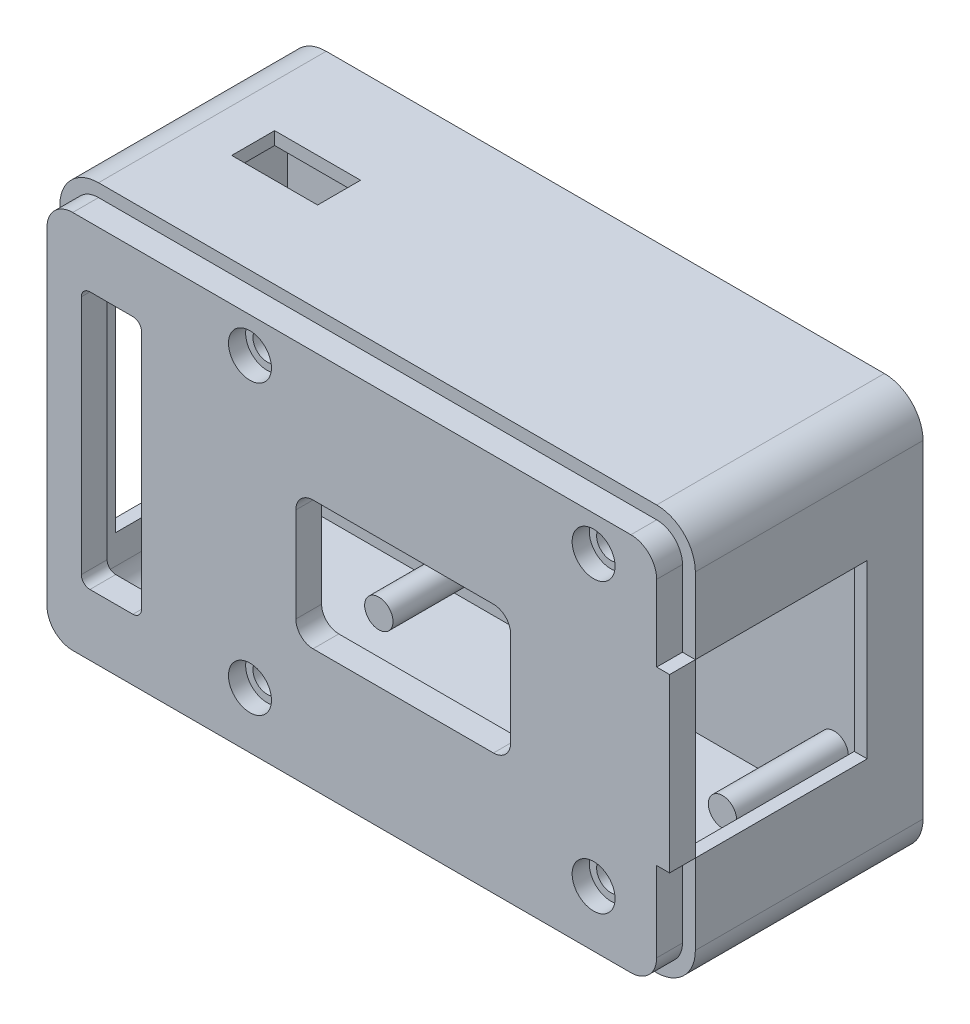
from build123d import *

# Parameters (mm, degrees)
EXTRUDE_3_DEPTH     = 25
EXTRUDE_4_DEPTH     = 1.5
SKETCH_3_R          = 1.65
EXTRUDE_6_DEPTH     = 13
CUT_EXTRUDE_1_REACH = 91.083
SKETCH_4_W          = 10
SKETCH_4_H          = 30
CUT_EXTRUDE_2_REACH = 91.083
SKETCH_5_W          = 20
SKETCH_5_H          = 20
CUT_EXTRUDE_3_REACH = 89.377
SKETCH_6_W          = 10
SKETCH_6_H          = 5
EXTRUDE_7_DEPTH     = 3
CUT_EXTRUDE_START   = -3
SKETCH_8_R          = 1.65
CUT_EXTRUDE_5_DEPTH = 3
CUT_EXTRUDE_6_DEPTH = 3
CUT_EXTRUDE_7_DEPTH = 3
SKETCH_11_R         = 2.5
CUT_EXTRUDE_8_DEPTH = 2


with BuildPart() as part:
    # 草图1 → 凸台-拉伸3 (new body)
    with BuildSketch(Plane.XY):
        with BuildLine():
            Line((-64.123292314, 2.629066518), (0.8422956, 2.629066518))
            ThreePointArc((0.8422956, 2.629066518), (4.024276115, 1.311047034), (5.3422956, -1.870933482))
            Line((5.3422956, -1.870933482), (5.3422956, -40.023345988))
            ThreePointArc((5.3422956, -40.023345988), (4.024276115, -43.205326503), (0.8422956, -44.523345988))
            Line((0.8422956, -44.523345988), (-64.123292314, -44.523345988))
            ThreePointArc((-64.123292314, -44.523345988), (-67.30527283, -43.205326503), (-68.623292314, -40.023345988))
            Line((-68.623292314, -40.023345988), (-68.623292314, -1.870933482))
            ThreePointArc((-68.623292314, -1.870933482), (-67.30527283, 1.311047034), (-64.123292314, 2.629066518))
        make_face()
        with BuildLine():
            Line((-64.123292314, 1.129066518), (0.8422956, 1.129066518))
            ThreePointArc((0.8422956, 1.129066518), (2.963615943, 0.250386862), (3.8422956, -1.870933482))
            Line((3.8422956, -1.870933482), (3.8422956, -40.023345988))
            ThreePointArc((3.8422956, -40.023345988), (2.963615943, -42.144666332), (0.8422956, -43.023345988))
            Line((0.8422956, -43.023345988), (-64.123292314, -43.023345988))
            ThreePointArc((-64.123292314, -43.023345988), (-66.244612658, -42.144666332), (-67.123292314, -40.023345988))
            Line((-67.123292314, -40.023345988), (-67.123292314, -1.870933482))
            ThreePointArc((-67.123292314, -1.870933482), (-66.244612658, 0.250386862), (-64.123292314, 1.129066518))
        make_face(mode=Mode.SUBTRACT)
    extrude(amount=-EXTRUDE_3_DEPTH)

    # 草图2 → 凸台-拉伸4 (add)
    with BuildSketch(Plane(origin=(0, 0, -25), x_dir=(-1, 0, 0), z_dir=(0, 0, -1))):
        with BuildLine():
            Line((64.123292314, 2.629066518), (-0.8422956, 2.629066518))
            ThreePointArc((-0.8422956, 2.629066518), (-4.024276115, 1.311047034), (-5.3422956, -1.870933482))
            Line((-5.3422956, -1.870933482), (-5.3422956, -40.023345988))
            ThreePointArc((-5.3422956, -40.023345988), (-4.024276115, -43.205326503), (-0.8422956, -44.523345988))
            Line((-0.8422956, -44.523345988), (64.123292314, -44.523345988))
            ThreePointArc((64.123292314, -44.523345988), (67.30527283, -43.205326503), (68.623292314, -40.023345988))
            Line((68.623292314, -40.023345988), (68.623292314, -1.870933482))
            ThreePointArc((68.623292314, -1.870933482), (67.30527283, 1.311047034), (64.123292314, 2.629066518))
        make_face()
    extrude(amount=EXTRUDE_4_DEPTH)

    # 草图3 → 凸台-拉伸6 (add)
    with BuildSketch(Plane.XY.offset(-25)):
        with Locations(Location((-43.499244891, -2.975515145, 0), (0, 0, 180))):
            Circle(SKETCH_3_R)
        with Locations(Location((-3.499244891, -2.975515145, 0), (0, 0, 180))):
            Circle(SKETCH_3_R)
        with Locations(Location((-3.499244891, -36.475515145, 0), (0, 0, 180))):
            Circle(SKETCH_3_R)
        with Locations(Location((-43.499244891, -36.475515145, 0), (0, 0, 180))):
            Circle(SKETCH_3_R)
    extrude(amount=EXTRUDE_6_DEPTH)

    # 草图4 → 切除-拉伸1 (cut, up to next)
    with BuildSketch(Plane(origin=(-67.123292314, 0, 0), x_dir=(0, 0, -1), z_dir=(1, 0, 0)), mode=Mode.PRIVATE) as cut_extrude_1_sk1:
        with Locations((10, -21.6396923)):
            Rectangle(SKETCH_4_W, SKETCH_4_H)
    cut_extrude_1_tool1 = extrude(cut_extrude_1_sk1.sketch, amount=-CUT_EXTRUDE_1_REACH, mode=Mode.PRIVATE) & part.part
    add(cut_extrude_1_tool1.solids().sort_by_distance((-67.123292, -21.639692, -10))[0], mode=Mode.SUBTRACT)

    # 草图5 → 切除-拉伸2 (cut, up to next)
    with BuildSketch(Plane.ZY.offset(-3.8422956), mode=Mode.PRIVATE) as cut_extrude_2_sk1:
        with Locations((-10, -20.713886057)):
            Rectangle(SKETCH_5_W, SKETCH_5_H)
    cut_extrude_2_tool1 = extrude(cut_extrude_2_sk1.sketch, amount=-CUT_EXTRUDE_2_REACH, mode=Mode.PRIVATE) & part.part
    add(cut_extrude_2_tool1.solids().sort_by_distance((3.842296, -20.713886, -10))[0], mode=Mode.SUBTRACT)

    # 草图6 → 切除-拉伸3 (cut, up to next)
    with BuildSketch(Plane(origin=(0, 2.629066518, 0), x_dir=(1, 0, 0), z_dir=(0, 1, 0)), mode=Mode.PRIVATE) as cut_extrude_3_sk1:
        with Locations((-54.123292314, 13)):
            Rectangle(SKETCH_6_W, SKETCH_6_H)
    cut_extrude_3_tool1 = extrude(cut_extrude_3_sk1.sketch, amount=-CUT_EXTRUDE_3_REACH, mode=Mode.PRIVATE) & part.part
    add(cut_extrude_3_tool1.solids().sort_by_distance((-54.123292, 2.629067, -13))[0], mode=Mode.SUBTRACT)


with BuildPart() as body_2:
    # 草图7 → 凸台-拉伸7 (new body)
    with BuildSketch(Plane.XY):
        with BuildLine():
            Line((5.3422956, -10.713886057), (5.3422956, -30.713886057))
            Line((5.3422956, -30.713886057), (3.8422956, -30.713886057))
            Line((3.8422956, -30.713886057), (3.8422956, -40.023345988))
            ThreePointArc((3.8422956, -40.023345988), (2.963615943, -42.144666332), (0.8422956, -43.023345988))
            Line((0.8422956, -43.023345988), (-64.123292314, -43.023345988))
            ThreePointArc((-64.123292314, -43.023345988), (-66.244612658, -42.144666332), (-67.123292314, -40.023345988))
            Line((-67.123292314, -40.023345988), (-67.123292314, -1.870933482))
            ThreePointArc((-67.123292314, -1.870933482), (-66.244612658, 0.250386862), (-64.123292314, 1.129066518))
            Line((-64.123292314, 1.129066518), (0.8422956, 1.129066518))
            ThreePointArc((0.8422956, 1.129066518), (2.963615943, 0.250386862), (3.8422956, -1.870933482))
            Line((3.8422956, -1.870933482), (3.8422956, -10.713886057))
            Line((3.8422956, -10.713886057), (5.3422956, -10.713886057))
        make_face()
    extrude(amount=EXTRUDE_7_DEPTH)

    # 草图8 → 切除-拉伸5 (cut)
    with BuildSketch(Plane.XY.offset(3).offset(CUT_EXTRUDE_START)):
        with Locations((-43.499244891, -2.975515145)):
            Circle(SKETCH_8_R)
        with Locations((-43.499244891, -36.475515145)):
            Circle(SKETCH_8_R)
        with Locations((-3.499244891, -2.975515145)):
            Circle(SKETCH_8_R)
        with Locations((-3.499244891, -36.475515145)):
            Circle(SKETCH_8_R)
    extrude(amount=CUT_EXTRUDE_5_DEPTH, mode=Mode.SUBTRACT)

    # 草图9 → 切除-拉伸6 (cut)
    with BuildSketch(Plane.XY.offset(3)):
        with BuildLine():
            Line((-62.123292314, -5.870933482), (-57.123292314, -5.870933482))
            ThreePointArc((-57.123292314, -5.870933482), (-56.416185533, -6.1638267), (-56.123292314, -6.870933482))
            Line((-56.123292314, -6.870933482), (-56.123292314, -34.870933482))
            ThreePointArc((-56.123292314, -34.870933482), (-56.416185533, -35.578040263), (-57.123292314, -35.870933482))
            Line((-57.123292314, -35.870933482), (-62.123292314, -35.870933482))
            ThreePointArc((-62.123292314, -35.870933482), (-62.830399096, -35.578040263), (-63.123292314, -34.870933482))
            Line((-63.123292314, -34.870933482), (-63.123292314, -6.870933482))
            ThreePointArc((-63.123292314, -6.870933482), (-62.830399096, -6.1638267), (-62.123292314, -5.870933482))
        make_face()
    extrude(amount=-CUT_EXTRUDE_6_DEPTH, mode=Mode.SUBTRACT)

    # 草图10 → 切除-拉伸7 (cut)
    with BuildSketch(Plane.XY.offset(3)):
        with BuildLine():
            Line((-36.1577044, -13.870933482), (-15.1577044, -13.870933482))
            ThreePointArc((-15.1577044, -13.870933482), (-13.743490838, -14.456719919), (-13.1577044, -15.870933482))
            Line((-13.1577044, -15.870933482), (-13.1577044, -26.870933482))
            ThreePointArc((-13.1577044, -26.870933482), (-13.743490838, -28.285147044), (-15.1577044, -28.870933482))
            Line((-15.1577044, -28.870933482), (-36.1577044, -28.870933482))
            ThreePointArc((-36.1577044, -28.870933482), (-37.571917963, -28.285147044), (-38.1577044, -26.870933482))
            Line((-38.1577044, -26.870933482), (-38.1577044, -15.870933482))
            ThreePointArc((-38.1577044, -15.870933482), (-37.571917963, -14.456719919), (-36.1577044, -13.870933482))
        make_face()
    extrude(amount=-CUT_EXTRUDE_7_DEPTH, mode=Mode.SUBTRACT)

    # 草图11 → 切除-拉伸8 (cut)
    with BuildSketch(Plane.XY.offset(3)):
        with Locations((-3.499244891, -36.475515145)):
            Circle(SKETCH_11_R)
        with Locations((-3.499244891, -2.975515145)):
            Circle(SKETCH_11_R)
        with Locations((-43.499244891, -2.975515145)):
            Circle(SKETCH_11_R)
        with Locations((-43.499244891, -36.475515145)):
            Circle(SKETCH_11_R)
    extrude(amount=-CUT_EXTRUDE_8_DEPTH, mode=Mode.SUBTRACT)


solid = Compound([part.part, body_2.part])
